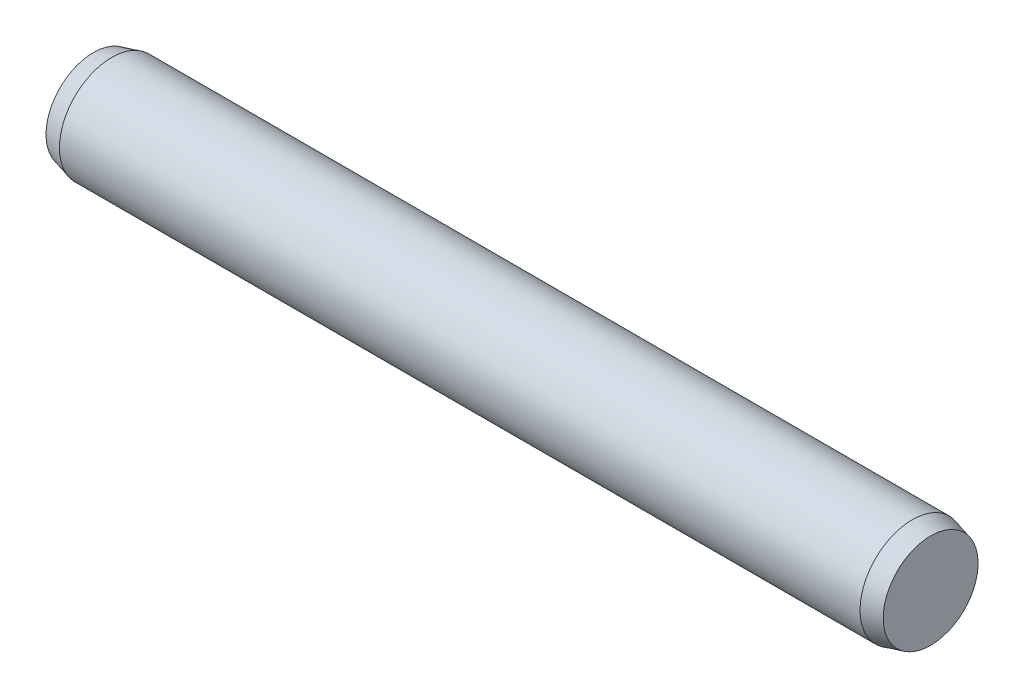
from build123d import *


with BuildPart() as part:
    # Sketch1 → Base-Revolve (revolve)
    with BuildSketch(Plane.XY, mode=Mode.PRIVATE) as base_revolve_sk:
        Polygon((0, 0), (16, 0), (16, 0.906217783), (15.65, 1), (0.35, 1), (0, 0.906217783), align=None)
    revolve(base_revolve_sk.sketch.rotate(Axis((-6.35, 0, 0), (1, 0, 0)), 90), axis=Axis((-6.35, 0, 0), (1, 0, 0)))


solid = part.part
